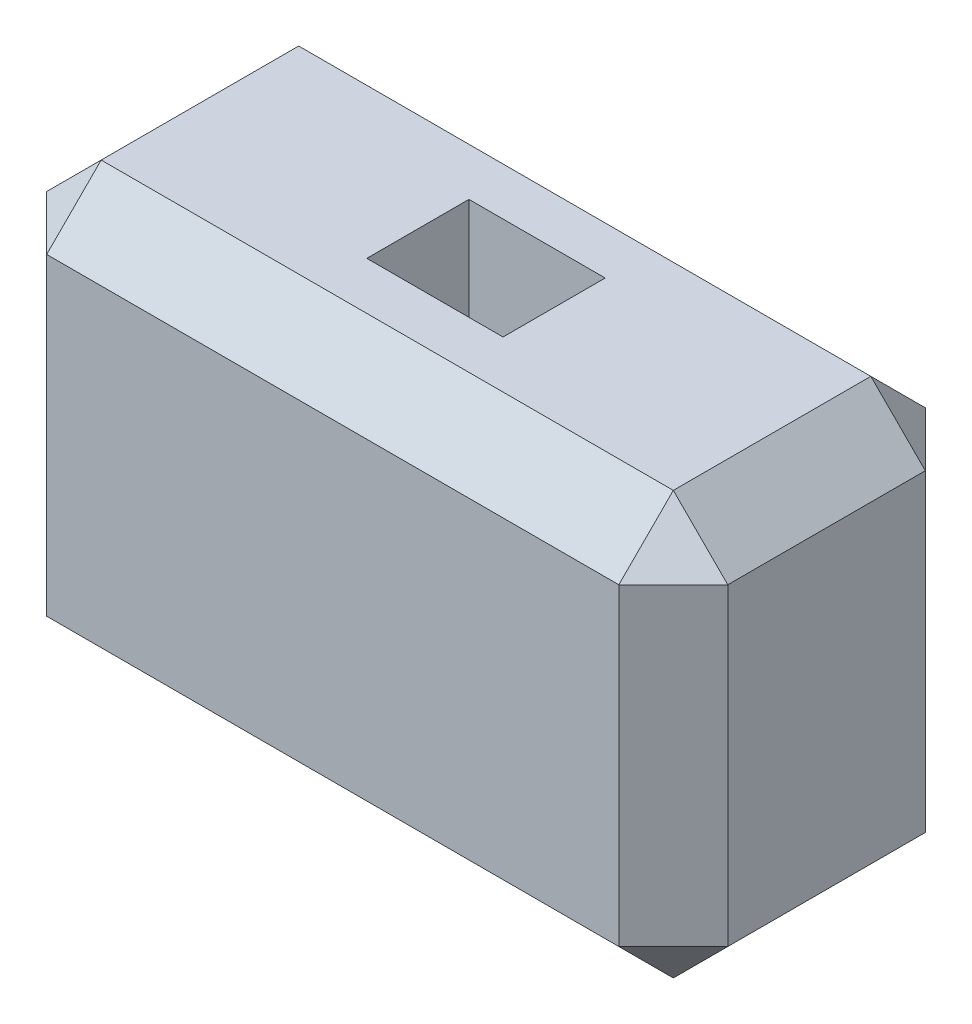
from build123d import *

# Parameters (mm, degrees)
SKETCH1_W           = 127
SKETCH1_H           = 78.74
BOSS_EXTRUDE1_DEPTH = 19.05
SKETCH2_W           = 50.8
SKETCH2_H           = 78.74
BOSS_EXTRUDE2_DEPTH = 19.05
SKETCH3_W           = 127
SKETCH3_H           = 78.74
BOSS_EXTRUDE3_DEPTH = 19.05
CHAMFER1_SIZE       = 10.16


with BuildPart() as part:
    # Sketch1 → Boss-Extrude1 (new body)
    with BuildSketch(Plane.XY):
        Rectangle(SKETCH1_W, SKETCH1_H)
    extrude(amount=BOSS_EXTRUDE1_DEPTH)

    # Sketch2 → Boss-Extrude2 (add)
    with BuildSketch(Plane.XY.offset(19.05)):
        with Locations((-38.1, 0)):
            Rectangle(SKETCH2_W, SKETCH2_H)
        with Locations((38.1, 0)):
            Rectangle(SKETCH2_W, SKETCH2_H)
    extrude(amount=BOSS_EXTRUDE2_DEPTH)

    # Sketch3 → Boss-Extrude3 (add)
    with BuildSketch(Plane.XY.offset(38.1)):
        Rectangle(SKETCH3_W, SKETCH3_H)
    extrude(amount=BOSS_EXTRUDE3_DEPTH)

    # Chamfer1
    chamfer1_edges = [part.edges().sort_by_distance(p)[0] for p in [
        (-63.5, 0, 57.15),
        (0, -39.37, 57.15),
        (63.5, 0, 57.15),
        (0, 39.37, 57.15),
        (0, -39.37, 0),
        (-63.5, 0, 0),
        (0, 39.37, 0),
        (63.5, 0, 0),
        (63.5, -39.37, 28.575),
        (-63.5, -39.37, 28.575),
        (-63.5, 39.37, 28.575),
        (63.5, 39.37, 28.575),
    ]]
    chamfer(chamfer1_edges, length=CHAMFER1_SIZE)


solid = part.part
